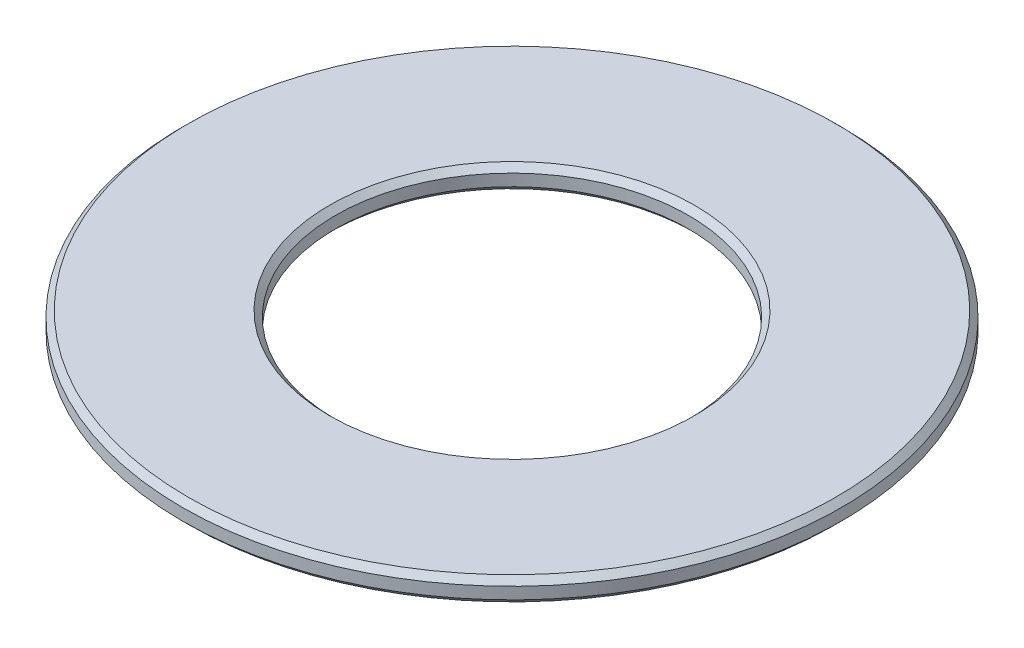
from build123d import *

# Parameters (mm, degrees)
SKETCH1_R           = 14
SKETCH1_R_2         = 7.5
BOSS_EXTRUDE1_DEPTH = 1
CHAMFER1_SIZE       = 0.25


with BuildPart() as part:
    # Sketch1 → Boss-Extrude1 (new body)
    with BuildSketch(Plane(origin=(0, 0, 0), x_dir=(1, 0, 0), z_dir=(0, 1, 0))):
        with Locations(Location((0, 0, 0), (0, 0, 270))):
            Circle(SKETCH1_R)
        with Locations(Location((0, 0, 0), (0, 0, 270))):
            Circle(SKETCH1_R_2, mode=Mode.SUBTRACT)
    extrude(amount=BOSS_EXTRUDE1_DEPTH)

    # Chamfer1
    chamfer1_edges = [part.edges().sort_by_distance(p)[0] for p in [
        (0, 0, -14),
        (0, 1, -14),
        (0, 0, -7.5),
        (0, 1, -7.5),
    ]]
    chamfer(chamfer1_edges, length=CHAMFER1_SIZE)


solid = part.part
